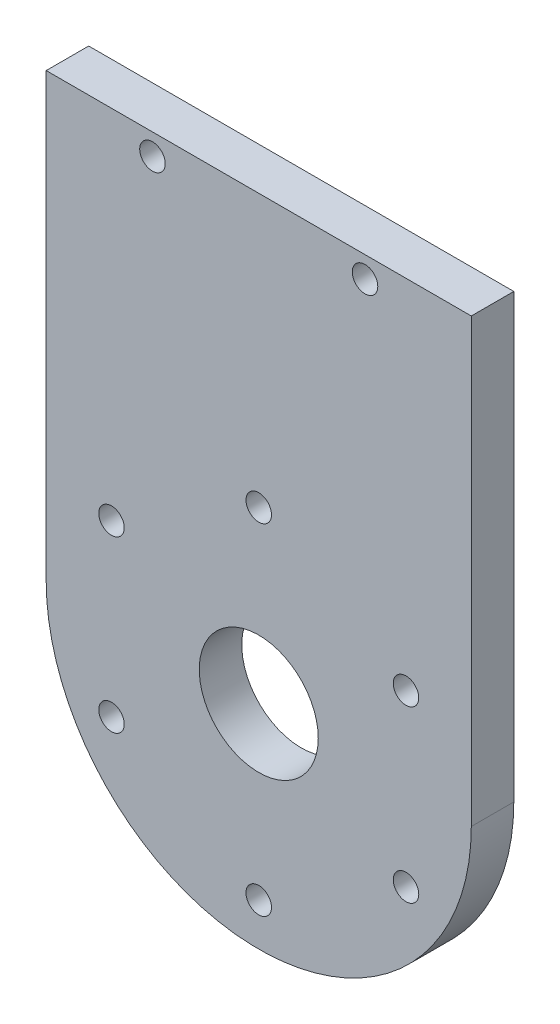
from build123d import *

# Parameters (mm, degrees)
ESQUISSE1_W             = 100
ESQUISSE1_H             = 100.548113933
ESQUISSE1_R             = 7
BOSS_EXTRU_1_DEPTH      = 5
ESQUISSE2_R             = 1.5
ENL_V_MAT_EXTRU_1_DEPTH = 73.311824759


with BuildPart() as part:
    # Esquisse1 → Boss.-Extru.1 (new body)
    with BuildSketch(Plane.XY):
        with Locations((0, 1.725943033)):
            Rectangle(ESQUISSE1_W, ESQUISSE1_H)
        Circle(ESQUISSE1_R, mode=Mode.SUBTRACT)
    extrude(amount=BOSS_EXTRU_1_DEPTH)

    # Esquisse2 → Enlèv. mat.-Extru.1 (cut, through all)
    with BuildSketch(Plane.XY.offset(5)):
        with BuildLine():
            Line((25, 52), (25, 0))
            ThreePointArc((25, 0), (0, -25), (-25, 0))
            Line((-25, 0), (-25, 52))
            Line((-25, 52), (-50, 52))
            Line((-50, 52), (-50, -48.548113933))
            Line((-50, -48.548113933), (50, -48.548113933))
            Line((50, -48.548113933), (50, 52))
            Line((50, 52), (25, 52))
        make_face()
        with Locations((0, -20)):
            Circle(ESQUISSE2_R)
        with Locations((-17.320508076, -10)):
            Circle(ESQUISSE2_R)
        with Locations((-17.320508076, 10)):
            Circle(ESQUISSE2_R)
        with Locations((17.320508076, -10)):
            Circle(ESQUISSE2_R)
        with Locations((0, 20)):
            Circle(ESQUISSE2_R)
        with Locations((17.320508076, 10)):
            Circle(ESQUISSE2_R)
        with Locations((-12.5, 49.5)):
            Circle(ESQUISSE2_R)
        with Locations((12.5, 49.5)):
            Circle(ESQUISSE2_R)
    extrude(amount=-ENL_V_MAT_EXTRU_1_DEPTH, mode=Mode.SUBTRACT)


solid = part.part
